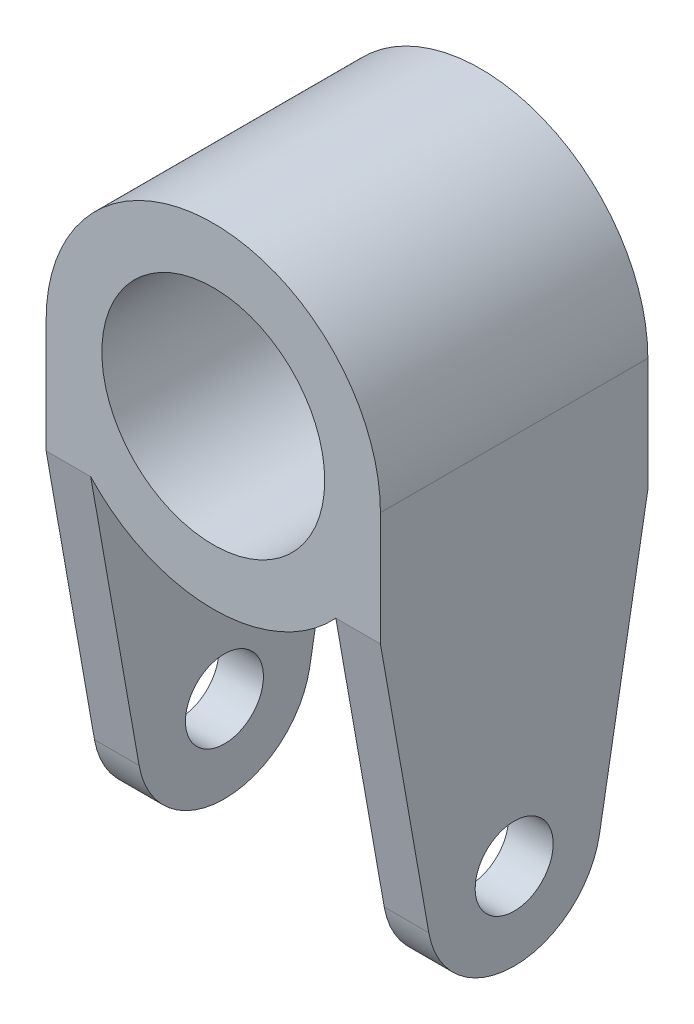
from build123d import *

# Parameters (mm, degrees)
SKETCH2_R           = 10
BOSS_EXTRUDE1_DEPTH = 24
CUT_EXTRUDE1_REACH  = 58.921
SKETCH3_R           = 3.5
CUT_EXTRUDE2_REACH  = 58.921
SKETCH4_R           = 3.5


with BuildPart() as part:
    # Sketch2 → Boss-Extrude1 (new body)
    with BuildSketch(Plane.XY):
        with BuildLine():
            Line((-15, 0), (-15, -15))
            Line((-15, -15), (-15, -42))
            Line((-15, -42), (-11, -42))
            Line((-11, -42), (-11, -10.198039027))
            ThreePointArc((-11, -10.198039027), (0, -15), (11, -10.198039027))
            Line((11, -10.198039027), (11, -42))
            Line((11, -42), (15, -42))
            Line((15, -42), (15, -22))
            Line((15, -22), (15, 0))
            ThreePointArc((15, 0), (0, 15), (-15, 0))
        make_face()
        Circle(SKETCH2_R, mode=Mode.SUBTRACT)
    extrude(amount=BOSS_EXTRUDE1_DEPTH)

    # Sketch3 → Cut-Extrude1 (cut, up to next)
    with BuildSketch(Plane.ZY.offset(15), mode=Mode.PRIVATE) as cut_extrude1_sk1:
        with Locations(Location((12, -33.467780556, 0), (0, 0, 270))):
            Circle(SKETCH3_R)
    cut_extrude1_tool1 = extrude(cut_extrude1_sk1.sketch, amount=-CUT_EXTRUDE1_REACH, mode=Mode.PRIVATE) & part.part
    # Sketch3 → Cut-Extrude1 (cut, up to next)
    with BuildSketch(Plane.ZY.offset(15), mode=Mode.PRIVATE) as cut_extrude1_sk2:
        with BuildLine():
            Line((0, -10.198039027), (4.341204442, -34.818232852))
            ThreePointArc((4.341204442, -34.818232852), (12, -41.244725381), (19.658795558, -34.818232852))
            Line((19.658795558, -34.818232852), (24, -10.198039027))
            Line((24, -10.198039027), (24, -42))
            Line((24, -42), (0, -42))
            Line((0, -42), (0, -10.198039027))
        make_face()
    cut_extrude1_tool2 = extrude(cut_extrude1_sk2.sketch, amount=-CUT_EXTRUDE1_REACH, mode=Mode.PRIVATE) & part.part
    add(cut_extrude1_tool1.solids().sort_by_distance((-15, -33.467781, 12))[0], mode=Mode.SUBTRACT)
    add(cut_extrude1_tool2.solids().sort_by_distance((-15, -22.57732, 1.778238))[0], mode=Mode.SUBTRACT)

    # Sketch4 → Cut-Extrude2 (cut, up to next)
    with BuildSketch(Plane(origin=(15, 0, 0), x_dir=(0, 0, -1), z_dir=(1, 0, 0)), mode=Mode.PRIVATE) as cut_extrude2_sk1:
        with Locations(Location((-12, -33.467780556, 0), (0, 0, 270))):
            Circle(SKETCH4_R)
    cut_extrude2_tool1 = extrude(cut_extrude2_sk1.sketch, amount=-CUT_EXTRUDE2_REACH, mode=Mode.PRIVATE) & part.part
    # Sketch4 → Cut-Extrude2 (cut, up to next)
    with BuildSketch(Plane(origin=(15, 0, 0), x_dir=(0, 0, -1), z_dir=(1, 0, 0)), mode=Mode.PRIVATE) as cut_extrude2_sk2:
        with BuildLine():
            Line((0, -10.198039027), (-4.341204442, -34.818232852))
            ThreePointArc((-4.341204442, -34.818232852), (-12, -41.244725381), (-19.658795558, -34.818232852))
            Line((-19.658795558, -34.818232852), (-24, -10.198039027))
            Line((-24, -10.198039027), (-24, -42))
            Line((-24, -42), (0, -42))
            Line((0, -42), (0, -10.198039027))
        make_face()
    cut_extrude2_tool2 = extrude(cut_extrude2_sk2.sketch, amount=-CUT_EXTRUDE2_REACH, mode=Mode.PRIVATE) & part.part
    add(cut_extrude2_tool1.solids().sort_by_distance((15, -33.467781, 12))[0], mode=Mode.SUBTRACT)
    add(cut_extrude2_tool2.solids().sort_by_distance((15, -22.57732, 1.778238))[0], mode=Mode.SUBTRACT)


solid = part.part
